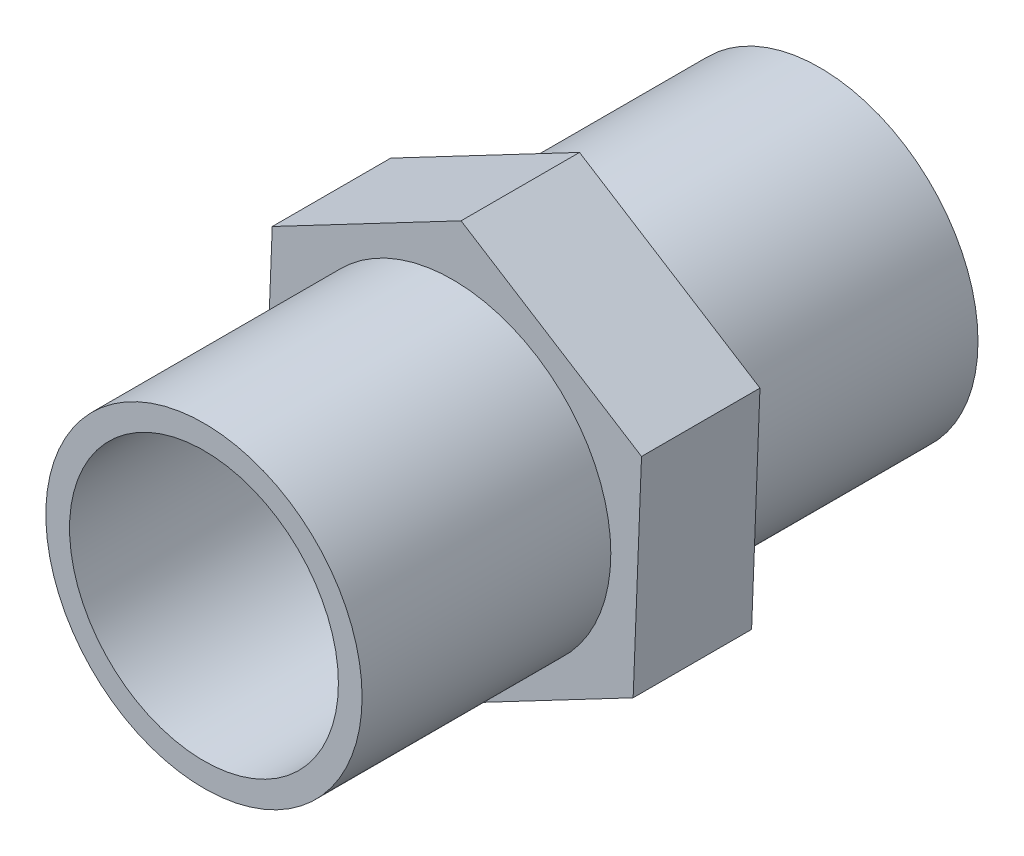
from build123d import *

# Parameters (mm, degrees)
SKETCH1_R           = 13.35
SKETCH1_R_2         = 11.35
EXTRUDE_THIN1_DEPTH = 26
BOSS_EXTRUDE1_DEPTH = 5


with BuildPart() as part:
    # Sketch1 → Extrude-Thin1 (new, symmetric)
    with BuildSketch(Plane.XY):
        Circle(SKETCH1_R)
        Circle(SKETCH1_R_2, mode=Mode.SUBTRACT)
    extrude(amount=EXTRUDE_THIN1_DEPTH, both=True)

    # Sketch2 → Boss-Extrude1 (add, symmetric)
    with BuildSketch(Plane.XY):
        Polygon((15.942171509, 8.387348964), (0.707428481, 18), (-15.234743028, 9.612651036), (-15.942171509, -8.387348964), (-0.707428481, -18), (15.234743028, -9.612651036), align=None)
    extrude(amount=BOSS_EXTRUDE1_DEPTH, both=True)


solid = part.part
